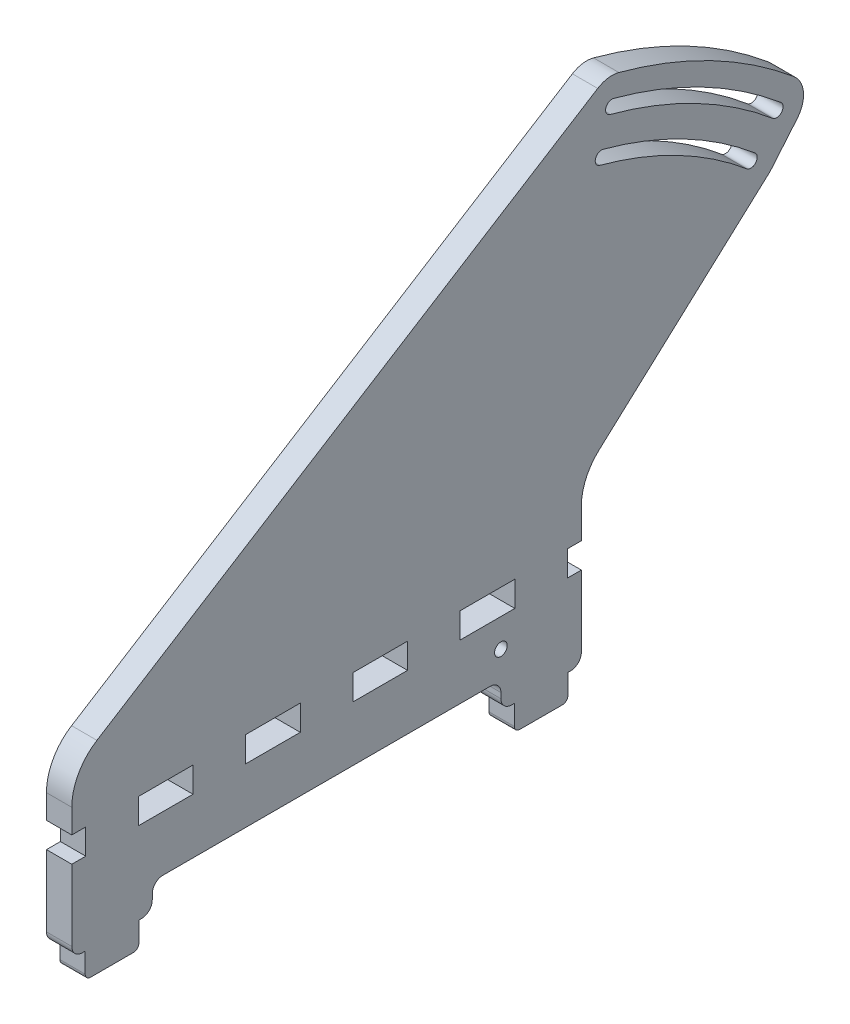
from build123d import *

# Parameters (mm, degrees)
MOUNTING_DEPTH          = 3
SKETCH3_R               = 1.5
BOSS_EXTRUDE2_DEPTH     = 6
PIVOTHOLE_DEPTH         = 133.681535985
PIVOTHOLE_DEPTH_BACK    = 133.681535985
SKETCH3_2_R             = 1.5
SKETCH4_W               = 6
SKETCH4_H               = 12.7
TAB_DEPTH               = 6
FILLET1_R               = 12.7
FILLET2_R               = 2.54
TABFILLET_R             = 1.27
CUT_EXTRUDE2_DEPTH      = 133.681535985
CUT_EXTRUDE2_DEPTH_BACK = 133.681535985
SKETCH5_W               = 12.954
SKETCH5_H               = 6


with BuildPart() as part:
    # Sketch2 → Mounting (new, symmetric)
    with BuildSketch(Plane(origin=(0, 0, 0), x_dir=(0, 0, -1), z_dir=(1, 0, 0))):
        Polygon((-60.325, -47.8), (-60.325, -9.7), (60.325, -9.7), (60.325, -47.8), (57.15, -47.8), (44.45, -47.8), (41.275, -47.8), (41.275, -41.45), (-41.275, -41.45), (-41.275, -47.8), (-44.45, -47.8), (-57.15, -47.8), align=None)
    extrude(amount=MOUNTING_DEPTH, both=True)

    # Sketch3 → Boss-Extrude2 (add)
    # profile 1 of 2: a face of its own
    with BuildSketch(Plane(origin=(3, 0, 0), x_dir=(0, 0, -1), z_dir=(1, 0, 0))):
        with Locations((41.275, -35.1)):
            Circle(SKETCH3_R)
    # profile 2 of 2: a face of its own
    with BuildSketch(Plane(origin=(3, 0, 0), x_dir=(0, 0, -1), z_dir=(1, 0, 0))):
        with BuildLine():
            Line((64.196478559, 68.417190639), (-60.325, -9.7))
            Line((-60.325, -9.7), (60.325, -9.7))
            Line((60.325, -9.7), (104.734943372, 30.73838178))
            ThreePointArc((104.734943372, 30.73838178), (105.039779736, 31.035237071), (105.324051376, 31.351840779))
            Line((105.324051376, 31.351840779), (111.446603358, 38.648414099))
            ThreePointArc((111.446603358, 38.648414099), (112.908057477, 43.283554387), (110.663922466, 47.594497635))
            ThreePointArc((110.663922466, 47.594497635), (91.120762799, 60.652819442), (69.214515919, 69.171692948))
            ThreePointArc((69.214515919, 69.171692948), (66.626854298, 69.317479577), (64.196478559, 68.417190639))
        make_face()
        with BuildLine():
            ThreePointArc((107.546402559, 43.879182086), (88.881282025, 56.350816901), (67.95924355, 64.48695269))
            ThreePointArc((67.95924355, 64.48695269), (66.122126243, 63.426292519), (67.182786415, 61.589175212))
            ThreePointArc((67.182786415, 61.589175212), (87.496036185, 53.689784401), (105.61803973, 41.581048756))
            ThreePointArc((105.61803973, 41.581048756), (107.731287809, 41.765934006), (107.546402559, 43.879182086))
        make_face(mode=Mode.SUBTRACT)
        with BuildLine():
            ThreePointArc((101.423850576, 36.582608765), (84.483126483, 47.902038715), (65.493992145, 55.286509195))
            ThreePointArc((65.493992145, 55.286509195), (63.656874838, 54.225849023), (64.71753501, 52.388731716))
            ThreePointArc((64.71753501, 52.388731716), (83.097880644, 45.241006215), (99.495487747, 34.284475436))
            ThreePointArc((99.495487747, 34.284475436), (101.608735827, 34.469360686), (101.423850576, 36.582608765))
        make_face(mode=Mode.SUBTRACT)
    extrude(amount=-BOSS_EXTRUDE2_DEPTH)

    # Sketch3<2> → PivotHole (cut, two sides: drawn at the far end of the back side and taken through both)
    with BuildSketch(Plane(origin=(3, 0, 0), x_dir=(0, 0, -1), z_dir=(1, 0, 0)).offset(-PIVOTHOLE_DEPTH_BACK)):
        with Locations((41.275, -35.1)):
            Circle(SKETCH3_2_R)
    extrude(amount=PIVOTHOLE_DEPTH + PIVOTHOLE_DEPTH_BACK, mode=Mode.SUBTRACT)

    # Sketch4 → Tab (add)
    with BuildSketch(Plane.XZ.offset(47.8)):
        with Locations((0, 50.8)):
            Rectangle(SKETCH4_W, SKETCH4_H)
        with Locations((0, -50.8)):
            Rectangle(SKETCH4_W, SKETCH4_H)
    extrude(amount=TAB_DEPTH)

    # Fillet1
    fillet1_edges = [part.edges().sort_by_distance(p)[0] for p in [
        (0, -9.7, 60.325),
        (0, -9.7, -60.325),
    ]]
    fillet(fillet1_edges, radius=FILLET1_R)

    # Fillet2
    fillet2_edges = [part.edges().sort_by_distance(p)[0] for p in [
        (0, -47.8, 60.325),
        (0, -47.8, -60.325),
        (0, -47.8, -41.275),
        (0, -41.45, -41.275),
        (0, -41.45, 41.275),
        (0, -47.8, 41.275),
    ]]
    fillet(fillet2_edges, radius=FILLET2_R)

    # TabFillet
    tabfillet_edges = [part.edges().sort_by_distance(p)[0] for p in [
        (0, -53.8, 57.15),
        (0, -53.8, 44.45),
        (0, -53.8, -44.45),
        (0, -53.8, -57.15),
    ]]
    fillet(tabfillet_edges, radius=TABFILLET_R)

    # Sketch5 → Cut-Extrude2 (cut, two sides: drawn at the far end of the back side and taken through both)
    with BuildSketch(Plane(origin=(3, 0, 0), x_dir=(0, 0, -1), z_dir=(1, 0, 0)).offset(-CUT_EXTRUDE2_DEPTH_BACK)):
        with Locations((-88.9, -25.4)):
            Rectangle(SKETCH5_W, SKETCH5_H)
        with Locations((-63.5, -25.4)):
            Rectangle(SKETCH5_W, SKETCH5_H)
        with Locations((-38.1, -25.4)):
            Rectangle(SKETCH5_W, SKETCH5_H)
        with Locations((-12.7, -25.4)):
            Rectangle(SKETCH5_W, SKETCH5_H)
        with Locations((12.7, -25.4)):
            Rectangle(SKETCH5_W, SKETCH5_H)
        with Locations((38.1, -25.4)):
            Rectangle(SKETCH5_W, SKETCH5_H)
        with Locations((63.5, -25.4)):
            Rectangle(SKETCH5_W, SKETCH5_H)
        with Locations((88.9, -25.4)):
            Rectangle(SKETCH5_W, SKETCH5_H)
    extrude(amount=CUT_EXTRUDE2_DEPTH + CUT_EXTRUDE2_DEPTH_BACK, mode=Mode.SUBTRACT)


solid = part.part
